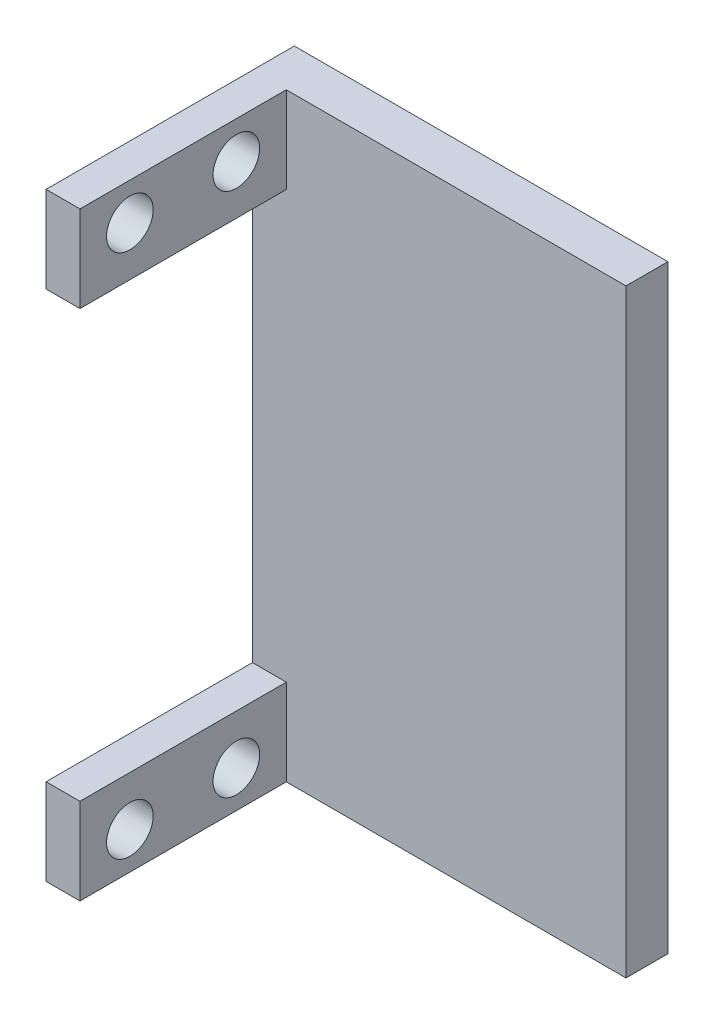
from build123d import *

# Parameters (mm, degrees)
SKETCH1_W           = 35.636
SKETCH1_H           = 55.178
BOSS_EXTRUDE1_DEPTH = 2
SKETCH2_W           = 3.23086443
SKETCH2_H           = 7.239
BOSS_EXTRUDE2_DEPTH = 19.685
SKETCH3_R           = 2.2225
CUT_EXTRUDE1_DEPTH  = 51.598920687
BOSS_EXTRUDE4_DEPTH = 1
BOSS_EXTRUDE5_DEPTH = 1


with BuildPart() as part:
    # Sketch1 → Boss-Extrude1 (new, symmetric)
    with BuildSketch(Plane.XY):
        with Locations((2.511331614, 1.04816211)):
            Rectangle(SKETCH1_W, SKETCH1_H)
    extrude(amount=BOSS_EXTRUDE1_DEPTH, both=True)

    # Sketch2 → Boss-Extrude2 (add)
    with BuildSketch(Plane.XY.offset(2)):
        with Locations((-13.691236171, 25.01766211)):
            Rectangle(SKETCH2_W, SKETCH2_H)
        with Locations((-13.691236171, -22.92133789)):
            Rectangle(SKETCH2_W, SKETCH2_H)
    extrude(amount=BOSS_EXTRUDE2_DEPTH)

    # Sketch3 → Cut-Extrude1 (cut, through all)
    with BuildSketch(Plane.ZY.offset(15.306668386)):
        with Locations(Location((16.9225, 26.09716211, 0), (0, 0, 270))):
            Circle(SKETCH3_R)
        with Locations(Location((16.9225, -24.00083789, 0), (0, 0, 270))):
            Circle(SKETCH3_R)
        with Locations(Location((6.7625, 26.09716211, 0), (0, 0, 270))):
            Circle(SKETCH3_R)
        with Locations(Location((6.7625, -24.00083789, 0), (0, 0, 270))):
            Circle(SKETCH3_R)
    extrude(amount=-CUT_EXTRUDE1_DEPTH, mode=Mode.SUBTRACT)

    # Sketch5 → Boss-Extrude4 (add)
    with BuildSketch(Plane.XZ.offset(26.54083789)):
        Polygon((-15.306668386, -2), (20.329331614, -2), (20.329331614, 2), (-12.075803956, 2), (-12.075803956, 21.685), (-15.306668386, 21.685), align=None)
    extrude(amount=BOSS_EXTRUDE4_DEPTH)

    # Sketch6 → Boss-Extrude5 (add)
    with BuildSketch(Plane(origin=(0, 28.63716211, 0), x_dir=(1, 0, 0), z_dir=(0, 1, 0))):
        Polygon((20.329331614, 2), (-15.306668386, 2), (-15.306668386, -21.685), (-12.075803956, -21.685), (-12.075803956, -2), (20.329331614, -2), align=None)
    extrude(amount=BOSS_EXTRUDE5_DEPTH)


solid = part.part
